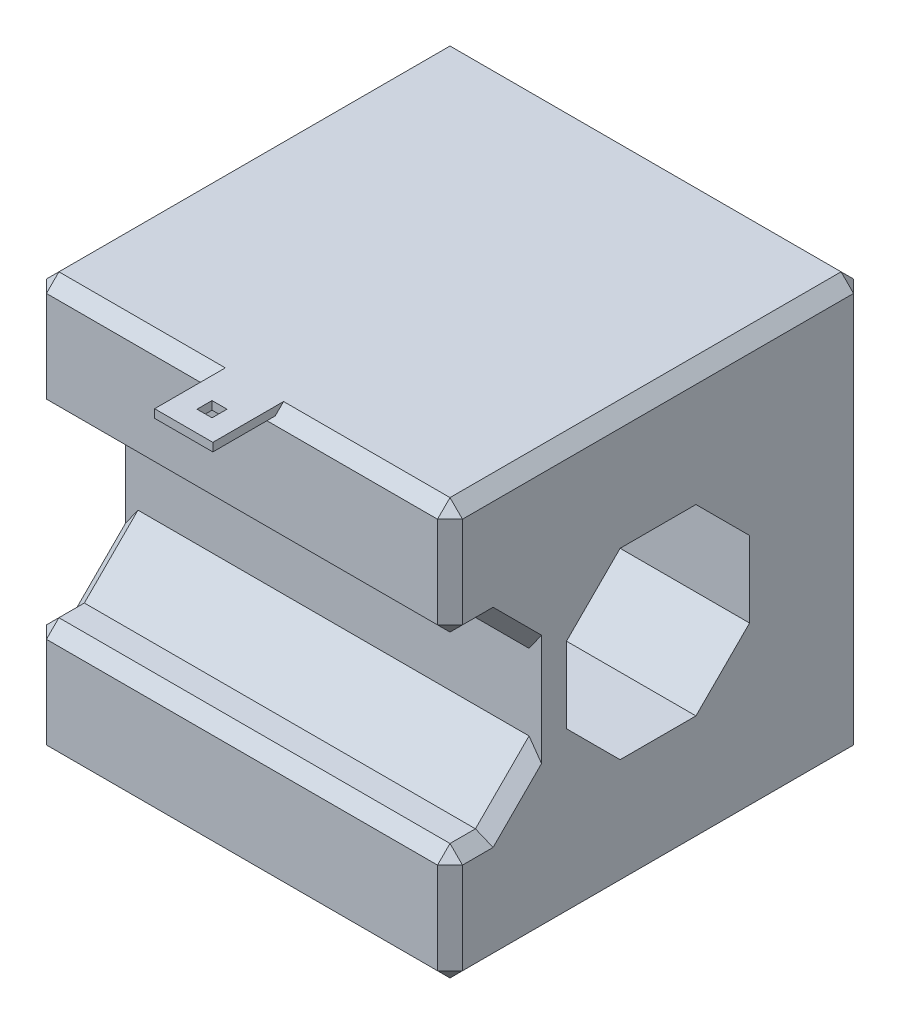
from build123d import *

# Parameters (mm, degrees)
SKETCH1_W                = 50
SKETCH1_H                = 50
BOSS_EXTRUDE1_DEPTH      = 50
CUT_EXTRUDE1_DEPTH       = 87.602540378
CHAMFER1_SIZE            = 1.5
BOSS_EXTRUDE2_DEPTH      = 7
BOSS_EXTRUDE2_DEPTH_BACK = 10
SKETCH3_W                = 7
SKETCH3_H                = 1
SKETCH4_W                = 1.8
SKETCH4_H                = 1.8
CUT_EXTRUDE2_DEPTH       = 7


with BuildPart() as part:
    # Sketch1 → Boss-Extrude1 (new body)
    with BuildSketch(Plane.XY):
        with Locations((25, 25)):
            Rectangle(SKETCH1_W, SKETCH1_H)
    extrude(amount=BOSS_EXTRUDE1_DEPTH)

    # Sketch2 → Cut-Extrude1 (cut, through all)
    with BuildSketch(Plane.ZY):
        Polygon((36, 29.556349186), (29.556349186, 36), (20.443650814, 36), (14, 29.556349186), (14, 20.443650814), (20.443650814, 14), (29.556349186, 14), (36, 20.443650814), align=None)
        Polygon((54.556349186, 36), (45.443650814, 36), (39, 29.556349186), (39, 20.443650814), (45.443650814, 14), (54.556349186, 14), (61, 20.443650814), (61, 29.556349186), align=None)
    extrude(amount=-CUT_EXTRUDE1_DEPTH, mode=Mode.SUBTRACT)

    # Chamfer1
    chamfer1_edges = [part.edges().sort_by_distance(p)[0] for p in [
        (50, 7, 50),
        (0, 7, 50),
        (50, 43, 50),
        (25, 36, 50),
        (25, 14, 50),
        (25, 50, 50),
        (50, 14, 47.721825407),
        (50, 36, 47.721825407),
        (0, 14, 47.721825407),
        (0, 36, 47.721825407),
        (0, 32.778174593, 42.221825407),
        (0, 17.221825407, 42.221825407),
        (50, 17.221825407, 42.221825407),
        (50, 32.778174593, 42.221825407),
        (0, 43, 50),
        (25, 50, 0),
        (50, 25, 0),
        (25, 0, 0),
        (0, 25, 0),
        (25, 0, 50),
        (0, 50, 25),
        (50, 50, 25),
        (50, 0, 25),
        (0, 0, 25),
    ]]
    chamfer(chamfer1_edges, length=CHAMFER1_SIZE)

    # Sketch3 → Boss-Extrude2 (add, two sides: drawn at the far end of the back side and taken through both)
    with BuildSketch(Plane.XY.offset(50).offset(-BOSS_EXTRUDE2_DEPTH_BACK)):
        with Locations((25, 49.5)):
            Rectangle(SKETCH3_W, SKETCH3_H)
    extrude(amount=BOSS_EXTRUDE2_DEPTH + BOSS_EXTRUDE2_DEPTH_BACK)

    # Sketch4 → Cut-Extrude2 (cut)
    with BuildSketch(Plane.XZ.offset(-49)):
        with Locations((25, 53.6)):
            Rectangle(SKETCH4_W, SKETCH4_H)
    extrude(amount=-CUT_EXTRUDE2_DEPTH, mode=Mode.SUBTRACT)


solid = part.part
